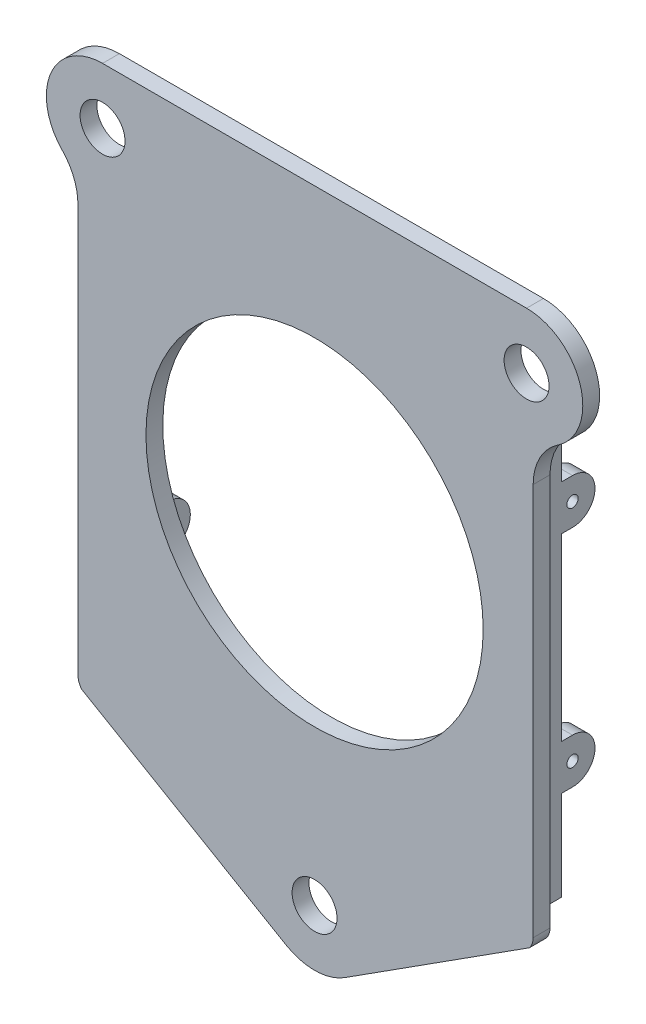
from build123d import *

# Parameters (mm, degrees)
CASING_EDGE_PROFILE_DEPTH                 = 3
SCREWHOLES_START                          = -3
SKETCH2_R                                 = 4
SCREWHOLES_AND_OTHER_STUFF_DEPTH          = 3
CASING_LIP_DEPTH                          = 5
CASING_LIP_FILLET_2MM_R                   = 2
FILLET_I_MISSED_IN_SCREWHOLE_ET_AL_SKET_R = 10
SKETCH4_R                                 = 1
SIDE_SCREWHOLES_1_DEPTH                   = 3
SIDE_START                                = -3
SKETCH6_R                                 = 1
SIDE_SCREWHOLES_2_DEPTH                   = 3
SKETCH7_R                                 = 1
TOP_SCREWHOLES_DEPTH                      = 3
CAMERA_HOLE_DEPTH                         = 166.235974691
CAMERA_HOLE_DEPTH_BACK                    = 166.235974691
SKETCH9_R                                 = 30


with BuildPart() as part:
    # Sketch1 → Casing edge profile (new body)
    with BuildSketch(Plane.XY.offset(105.601550083)):
        with BuildLine():
            Line((93.845211173, 26.628512047), (97.718517255, 26.628512047))
            ThreePointArc((97.718517255, 26.628512047), (98.220764918, 27.518839518), (98.394920872, 28.526115759))
            Line((98.394920872, 28.526115759), (98.394920872, 105.956761374))
            ThreePointArc((98.394920872, 105.956761374), (97.516241216, 108.078081718), (95.394920872, 108.956761374))
            Line((95.394920872, 108.956761374), (20.394920872, 108.956761374))
            ThreePointArc((20.394920872, 108.956761374), (18.273600528, 108.078081718), (17.394920872, 105.956761374))
            Line((17.394920872, 105.956761374), (17.394920872, 28.526115759))
            ThreePointArc((17.394920872, 28.526115759), (17.569076826, 27.518839518), (18.071324489, 26.628512047))
            Line((18.071324489, 26.628512047), (21.944630571, 26.628512047))
            Line((21.944630571, 26.628512047), (20.845856617, 27.973949541))
            ThreePointArc((20.845856617, 27.973949541), (20.511024841, 28.567501189), (20.394920872, 29.239018683))
            Line((20.394920872, 29.239018683), (20.394920872, 103.956761374))
            ThreePointArc((20.394920872, 103.956761374), (20.98070731, 105.370974936), (22.394920872, 105.956761374))
            Line((22.394920872, 105.956761374), (93.394920872, 105.956761374))
            ThreePointArc((93.394920872, 105.956761374), (94.809134434, 105.370974936), (95.394920872, 103.956761374))
            Line((95.394920872, 103.956761374), (95.394920872, 29.239018683))
            ThreePointArc((95.394920872, 29.239018683), (95.278816903, 28.567501189), (94.943985127, 27.973949541))
            Line((94.943985127, 27.973949541), (93.845211173, 26.628512047))
        make_face()
    extrude(amount=CASING_EDGE_PROFILE_DEPTH)

    # Sketch2 → Screwholes and other stuff (add)
    # profile 1 of 3: a face of its own
    with BuildSketch(Plane.XY.offset(108.601550083).offset(SCREWHOLES_START)):
        with BuildLine():
            ThreePointArc((102.80865071, 106.646950035), (106.786425162, 117.861593749), (97.222380548, 124.941139909))
            Line((97.222380548, 124.941139909), (21.775592214, 124.941139909))
            ThreePointArc((21.775592214, 124.941139909), (12.031511294, 117.189002678), (17.394920872, 105.951717314))
            Line((17.394920872, 105.951717314), (17.394920872, 105.956761374))
            ThreePointArc((17.394920872, 105.956761374), (18.273600528, 108.078081718), (20.394920872, 108.956761374))
            Line((20.394920872, 108.956761374), (95.394920872, 108.956761374))
            ThreePointArc((95.394920872, 108.956761374), (97.516241216, 108.078081718), (98.394920872, 105.956761374))
            Line((98.394920872, 105.956761374), (98.394920872, 98.35276016))
            ThreePointArc((98.394920872, 98.35276016), (99.567047356, 103.050488248), (102.80865071, 106.646950035))
        make_face()
        with Locations((21.775592214, 114.941139909)):
            Circle(SKETCH2_R, mode=Mode.SUBTRACT)
        with Locations((97.222380548, 114.941139909)):
            Circle(SKETCH2_R, mode=Mode.SUBTRACT)
    # profile 2 of 3: a face of its own
    with BuildSketch(Plane.XY.offset(108.601550083).offset(SCREWHOLES_START)):
        with BuildLine():
            Line((17.394920872, 105.956761374), (17.394920872, 105.951717314))
            Line((17.394920872, 105.951717314), (17.394920872, 28.526115759))
            ThreePointArc((17.394920872, 28.526115759), (17.569076826, 27.518839518), (18.071324489, 26.628512047))
            Line((18.071324489, 26.628512047), (21.944630571, 26.628512047))
            Line((21.944630571, 26.628512047), (20.845856617, 27.973949541))
            ThreePointArc((20.845856617, 27.973949541), (20.511024841, 28.567501189), (20.394920872, 29.239018683))
            Line((20.394920872, 29.239018683), (20.394920872, 103.956761374))
            ThreePointArc((20.394920872, 103.956761374), (20.98070731, 105.370974936), (22.394920872, 105.956761374))
            Line((22.394920872, 105.956761374), (93.394920872, 105.956761374))
            ThreePointArc((93.394920872, 105.956761374), (94.809134434, 105.370974936), (95.394920872, 103.956761374))
            Line((95.394920872, 103.956761374), (95.394920872, 29.239018683))
            ThreePointArc((95.394920872, 29.239018683), (95.278816903, 28.567501189), (94.943985127, 27.973949541))
            Line((94.943985127, 27.973949541), (93.845211173, 26.628512047))
            Line((93.845211173, 26.628512047), (97.718517255, 26.628512047))
            ThreePointArc((97.718517255, 26.628512047), (98.220764918, 27.518839518), (98.394920872, 28.526115759))
            Line((98.394920872, 28.526115759), (98.394920872, 98.35276016))
            Line((98.394920872, 98.35276016), (98.394920872, 105.956761374))
            ThreePointArc((98.394920872, 105.956761374), (97.516241216, 108.078081718), (95.394920872, 108.956761374))
            Line((95.394920872, 108.956761374), (20.394920872, 108.956761374))
            ThreePointArc((20.394920872, 108.956761374), (18.273600528, 108.078081718), (17.394920872, 105.956761374))
        make_face()
    # profile 3 of 3: a face of its own
    with BuildSketch(Plane.XY.offset(108.601550083).offset(SCREWHOLES_START)):
        with BuildLine():
            Line((18.071324489, 26.628512047), (54.461325843, 5.406937788))
            ThreePointArc((54.461325843, 5.406937788), (59.705268559, 4.04746689), (64.888673445, 5.622081164))
            Line((64.888673445, 5.622081164), (97.718517255, 26.628512047))
            Line((97.718517255, 26.628512047), (93.845211173, 26.628512047))
            Line((93.845211173, 26.628512047), (94.943985127, 27.973949541))
            ThreePointArc((94.943985127, 27.973949541), (95.278816903, 28.567501189), (95.394920872, 29.239018683))
            Line((95.394920872, 29.239018683), (95.394920872, 103.956761374))
            ThreePointArc((95.394920872, 103.956761374), (94.809134434, 105.370974936), (93.394920872, 105.956761374))
            Line((93.394920872, 105.956761374), (22.394920872, 105.956761374))
            ThreePointArc((22.394920872, 105.956761374), (20.98070731, 105.370974936), (20.394920872, 103.956761374))
            Line((20.394920872, 103.956761374), (20.394920872, 29.239018683))
            ThreePointArc((20.394920872, 29.239018683), (20.511024841, 28.567501189), (20.845856617, 27.973949541))
            Line((20.845856617, 27.973949541), (21.944630571, 26.628512047))
            Line((21.944630571, 26.628512047), (18.071324489, 26.628512047))
        make_face()
        with Locations((59.498986381, 14.045339047)):
            Circle(SKETCH2_R, mode=Mode.SUBTRACT)
    extrude(amount=SCREWHOLES_AND_OTHER_STUFF_DEPTH)

    # Sketch3 → Casing lip (add)
    with BuildSketch(Plane(origin=(0, 0, 105.601550083), x_dir=(-1, 0, 0), z_dir=(0, 0, -1))):
        with BuildLine():
            Line((-20.394920872, 103.956761374), (-20.394920872, 29.239018683))
            Line((-20.394920872, 29.239018683), (-23.394920872, 29.239018683))
            Line((-23.394920872, 29.239018683), (-23.394920872, 102.956761374))
            Line((-23.394920872, 102.956761374), (-92.394920872, 102.956761374))
            Line((-92.394920872, 102.956761374), (-92.394920872, 29.239018683))
            Line((-92.394920872, 29.239018683), (-95.394920872, 29.239018683))
            Line((-95.394920872, 29.239018683), (-95.394920872, 103.956761374))
            ThreePointArc((-95.394920872, 103.956761374), (-94.809134434, 105.370974936), (-93.394920872, 105.956761374))
            Line((-93.394920872, 105.956761374), (-22.394920872, 105.956761374))
            ThreePointArc((-22.394920872, 105.956761374), (-20.98070731, 105.370974936), (-20.394920872, 103.956761374))
        make_face()
    extrude(amount=CASING_LIP_DEPTH)

    # Casing lip fillet 2mm
    casing_lip_fillet_2mm_edges = [part.edges().sort_by_distance(p)[0] for p in [
        (92.394920872, 66.097890028, 105.601550083),
        (57.894920872, 102.956761374, 105.601550083),
        (92.394920872, 102.956761374, 103.101550083),
        (23.394920872, 66.097890028, 105.601550083),
        (23.394920872, 102.956761374, 103.101550083),
    ]]
    fillet(casing_lip_fillet_2mm_edges, radius=CASING_LIP_FILLET_2MM_R)

    # Fillet I missed in screwhole et al. sketch
    fillet_i_missed_in_screwhole_et_al_sket_edges = [part.edges().sort_by_distance(p)[0] for p in [
        (17.394920872, 105.951717314, 107.101550083),
    ]]
    fillet(fillet_i_missed_in_screwhole_et_al_sket_edges, radius=FILLET_I_MISSED_IN_SCREWHOLE_ET_AL_SKET_R)

    # Sketch4 → Side screwholes 1 (add)
    # profile 1 of 2: a face of its own
    with BuildSketch(Plane(origin=(95.394920872, 0, 0), x_dir=(0, 0, -1), z_dir=(1, 0, 0))):
        with BuildLine():
            Line((-98.601550083, 93.239018683), (-100.601550083, 93.239018683))
            Line((-100.601550083, 93.239018683), (-100.601550083, 85.239018683))
            Line((-100.601550083, 85.239018683), (-98.601550083, 85.239018683))
            ThreePointArc((-98.601550083, 85.239018683), (-94.601550083, 89.239018683), (-98.601550083, 93.239018683))
        make_face()
        with Locations(Location((-98.601550083, 89.239018683, 0), (0, 0, 90))):
            Circle(SKETCH4_R, mode=Mode.SUBTRACT)
    # profile 2 of 2: a face of its own
    with BuildSketch(Plane(origin=(95.394920872, 0, 0), x_dir=(0, 0, -1), z_dir=(1, 0, 0))):
        with BuildLine():
            Line((-98.601550083, 53.239018683), (-100.601550083, 53.239018683))
            Line((-100.601550083, 53.239018683), (-100.601550083, 45.239018683))
            Line((-100.601550083, 45.239018683), (-98.601550083, 45.239018683))
            ThreePointArc((-98.601550083, 45.239018683), (-94.601550083, 49.239018683), (-98.601550083, 53.239018683))
        make_face()
        with Locations(Location((-98.601550083, 49.239018683, 0), (0, 0, 90))):
            Circle(SKETCH4_R, mode=Mode.SUBTRACT)
    extrude(amount=-SIDE_SCREWHOLES_1_DEPTH)

    # Sketch6 → Side screwholes 2 (add)
    with BuildSketch(Plane.ZY.offset(-20.394920872).offset(SIDE_START)):
        with BuildLine():
            Line((100.601550083, 29.239018683), (103.601550083, 29.239018683))
            Line((103.601550083, 29.239018683), (103.601550083, 100.956761374))
            Line((103.601550083, 100.956761374), (100.601550083, 100.956761374))
            Line((100.601550083, 100.956761374), (100.601550083, 93.239018683))
            Line((100.601550083, 93.239018683), (98.601550083, 93.239018683))
            ThreePointArc((98.601550083, 93.239018683), (94.601550083, 89.239018683), (98.601550083, 85.239018683))
            Line((98.601550083, 85.239018683), (100.601550083, 85.239018683))
            Line((100.601550083, 85.239018683), (100.601550083, 53.239018683))
            Line((100.601550083, 53.239018683), (98.601550083, 53.239018683))
            ThreePointArc((98.601550083, 53.239018683), (94.601550083, 49.239018683), (98.601550083, 45.239018683))
            Line((98.601550083, 45.239018683), (100.601550083, 45.239018683))
            Line((100.601550083, 45.239018683), (100.601550083, 29.239018683))
        make_face()
        with Locations(Location((98.601550083, 49.239018683, 0), (0, 0, 90))):
            Circle(SKETCH6_R, mode=Mode.SUBTRACT)
        with Locations(Location((98.601550083, 89.239018683, 0), (0, 0, 90))):
            Circle(SKETCH6_R, mode=Mode.SUBTRACT)
    extrude(amount=SIDE_SCREWHOLES_2_DEPTH)

    # Sketch7 → Top screwholes (add)
    # profile 1 of 2: a face of its own
    with BuildSketch(Plane(origin=(0, 105.956761374, 0), x_dir=(1, 0, 0), z_dir=(0, 1, 0))):
        with BuildLine():
            Line((39.394920872, -100.601550083), (47.394920872, -100.601550083))
            Line((47.394920872, -100.601550083), (47.394920872, -98.601550083))
            ThreePointArc((47.394920872, -98.601550083), (43.394920872, -94.601550083), (39.394920872, -98.601550083))
            Line((39.394920872, -98.601550083), (39.394920872, -100.601550083))
        make_face()
        with Locations(Location((43.394920872, -98.601550083, 0), (0, 0, 180))):
            Circle(SKETCH7_R, mode=Mode.SUBTRACT)
    # profile 2 of 2: a face of its own
    with BuildSketch(Plane(origin=(0, 105.956761374, 0), x_dir=(1, 0, 0), z_dir=(0, 1, 0))):
        with BuildLine():
            Line((68.394920872, -98.601550083), (68.394920872, -100.601550083))
            Line((68.394920872, -100.601550083), (76.394920872, -100.601550083))
            Line((76.394920872, -100.601550083), (76.394920872, -98.601550083))
            ThreePointArc((76.394920872, -98.601550083), (72.394920872, -94.601550083), (68.394920872, -98.601550083))
        make_face()
        with Locations(Location((72.394920872, -98.601550083, 0), (0, 0, 180))):
            Circle(SKETCH7_R, mode=Mode.SUBTRACT)
    extrude(amount=-TOP_SCREWHOLES_DEPTH)

    # Sketch9 → Camera hole (cut, two sides: drawn at the far end of the back side and taken through both)
    with BuildSketch(Plane.XY.offset(108.601550083).offset(-CAMERA_HOLE_DEPTH_BACK)):
        with Locations((59.498986381, 71.545339047)):
            Circle(SKETCH9_R)
    extrude(amount=CAMERA_HOLE_DEPTH + CAMERA_HOLE_DEPTH_BACK, mode=Mode.SUBTRACT)


solid = part.part
